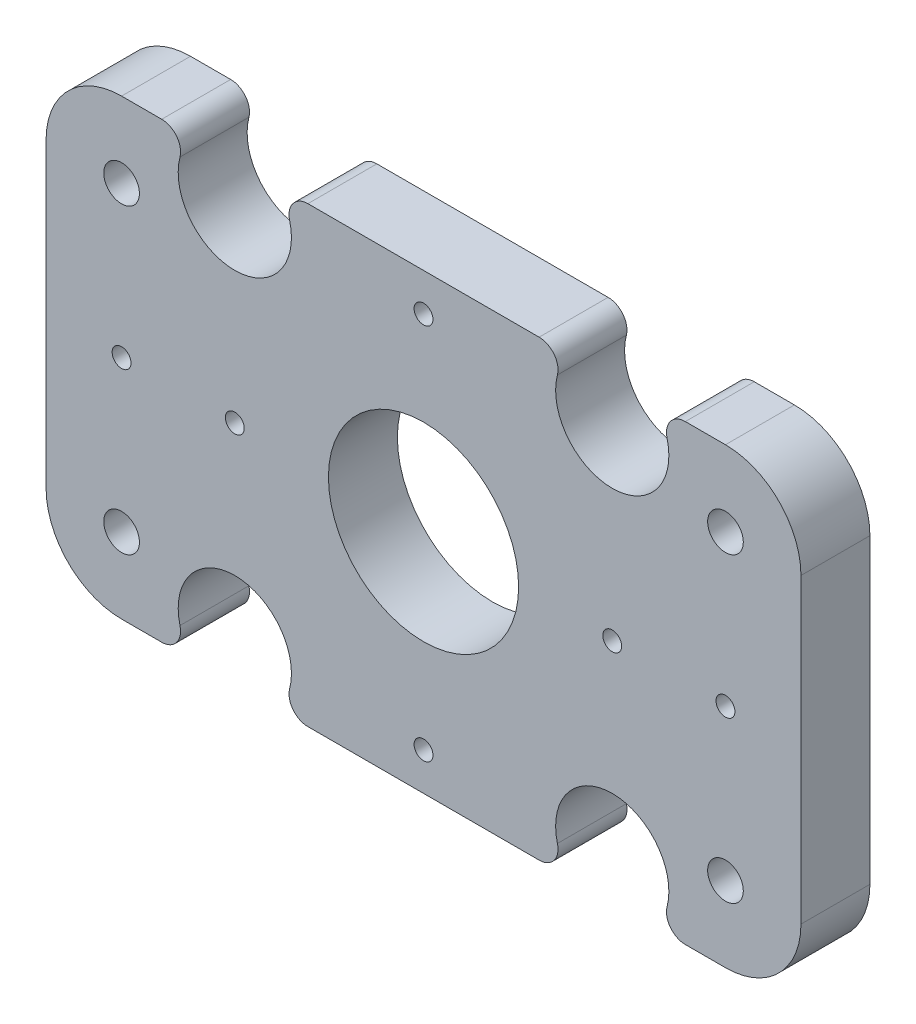
from build123d import *

# Parameters (mm, degrees)
SKETCH1_W                       = 38.1
SKETCH1_H                       = 38.1
BOSS_EXTRUDE1_DEPTH             = 5.8
SKETCH2_R                       = 8
CUT_EXTRUDE1_DEPTH              = 12.7
SKETCH4_R                       = 0.79375
CUT_EXTRUDE3_DEPTH              = 55.19280395
SKETCH6_W                       = 12.7
SKETCH6_H                       = 38.1
BOSS_EXTRUDE2_DEPTH             = 5.8
CUT_EXTRUDE2_DEPTH              = 64.764331722
M3X0_5_TAPPED_HOLE1_D           = 2.5
M3X0_5_TAPPED_HOLE1_DEPTH       = 7.5
M3X0_5_TAPPED_HOLE1_CBORE_D     = 3
M3X0_5_TAPPED_HOLE1_CBORE_DEPTH = 6
M3X0_5_TAPPED_HOLE1_TIP         = 0.751075774
SKETCH9_R                       = 0.79375
CUT_EXTRUDE4_DEPTH              = 64.764331722
FILLET1_R                       = 6.35
FILLET2_R                       = 1.5875


with BuildPart() as part:
    # Sketch1 → Boss-Extrude1 (new body)
    with BuildSketch(Plane.XY):
        with Locations((-19.05, 19.05)):
            Rectangle(SKETCH1_W, SKETCH1_H)
    extrude(amount=BOSS_EXTRUDE1_DEPTH)

    # Sketch2 → Cut-Extrude1 (cut)
    with BuildSketch(Plane.XY.offset(5.8)):
        with Locations((-19.05, 19.05)):
            Circle(SKETCH2_R)
    extrude(amount=-CUT_EXTRUDE1_DEPTH, mode=Mode.SUBTRACT)

    # Sketch4 → Cut-Extrude3 (cut, through all)
    with BuildSketch(Plane.XY.offset(5.8)):
        with Locations((-34.925, 19.05)):
            Circle(SKETCH4_R)
        with Locations((-19.05, 34.925)):
            Circle(SKETCH4_R)
        with Locations((-3.175, 19.05)):
            Circle(SKETCH4_R)
        with Locations((-19.05, 3.175)):
            Circle(SKETCH4_R)
    extrude(amount=-CUT_EXTRUDE3_DEPTH, mode=Mode.SUBTRACT)

    # Sketch6 → Boss-Extrude2 (add, through all)
    with BuildSketch(Plane.XY.offset(5.8)):
        with Locations((6.35, 19.05)):
            Rectangle(SKETCH6_W, SKETCH6_H)
        with Locations((-44.45, 19.05)):
            Rectangle(SKETCH6_W, SKETCH6_H)
    extrude(amount=-BOSS_EXTRUDE2_DEPTH)

    # Sketch3 → Cut-Extrude2 (cut, through all)
    with BuildSketch(Plane.XY.offset(5.8)):
        with BuildLine():
            Line((-38.1, 38.1), (-31.375242086, 38.1))
            ThreePointArc((-31.375242086, 38.1), (-34.925, 30.1625), (-38.474757914, 38.1))
            Line((-38.474757914, 38.1), (-38.1, 38.1))
        make_face()
        with BuildLine():
            Line((0, 38.1), (-6.724757914, 38.1))
            ThreePointArc((-6.724757914, 38.1), (-3.175, 30.1625), (0.374757914, 38.1))
            Line((0.374757914, 38.1), (0, 38.1))
        make_face()
        with BuildLine():
            Line((0, 0), (-6.724757914, 0))
            ThreePointArc((-6.724757914, 0), (-3.175, 7.9375), (0.374757914, 0))
            Line((0.374757914, 0), (0, 0))
        make_face()
        with BuildLine():
            Line((-38.1, 0), (-31.375242086, 0))
            ThreePointArc((-31.375242086, 0), (-34.925, 7.9375), (-38.474757914, 0))
            Line((-38.474757914, 0), (-38.1, 0))
        make_face()
    extrude(amount=-CUT_EXTRUDE2_DEPTH, mode=Mode.SUBTRACT)

    # M3x0.5 Tapped Hole1
    with Locations(Plane.XY.offset(5.8)):
        with Locations((-44.45, 31.75), (6.35, 31.75), (6.35, 6.35), (-44.45, 6.35)):
            CounterBoreHole(M3X0_5_TAPPED_HOLE1_D / 2, M3X0_5_TAPPED_HOLE1_CBORE_D / 2, M3X0_5_TAPPED_HOLE1_CBORE_DEPTH, depth=M3X0_5_TAPPED_HOLE1_DEPTH)
            with Locations((0, 0, -(M3X0_5_TAPPED_HOLE1_DEPTH + M3X0_5_TAPPED_HOLE1_TIP / 2))):  # 118° drill point
                Cone(0, M3X0_5_TAPPED_HOLE1_D / 2, M3X0_5_TAPPED_HOLE1_TIP, mode=Mode.SUBTRACT)

    # Sketch9 → Cut-Extrude4 (cut, through all)
    with BuildSketch(Plane.XY.offset(5.8)):
        with Locations((-44.45, 19.05)):
            Circle(SKETCH9_R)
        with Locations((6.35, 19.05)):
            Circle(SKETCH9_R)
    extrude(amount=-CUT_EXTRUDE4_DEPTH, mode=Mode.SUBTRACT)

    # Fillet1
    fillet1_edges = [part.edges().sort_by_distance(p)[0] for p in [
        (12.7, 38.1, 2.9),
        (12.7, 0, 2.9),
        (-50.8, 0, 2.9),
        (-50.8, 38.1, 2.9),
    ]]
    fillet(fillet1_edges, radius=FILLET1_R)

    # Fillet2
    fillet2_edges = [part.edges().sort_by_distance(p)[0] for p in [
        (-38.474757914, 38.1, 2.9),
        (-31.375242086, 38.1, 2.9),
        (0.374757914, 0, 2.9),
        (-6.724757914, 0, 2.9),
        (0.374757914, 38.1, 2.9),
        (-6.724757914, 38.1, 2.9),
        (-38.474757914, 0, 2.9),
        (-31.375242086, 0, 2.9),
    ]]
    fillet(fillet2_edges, radius=FILLET2_R)


solid = part.part
